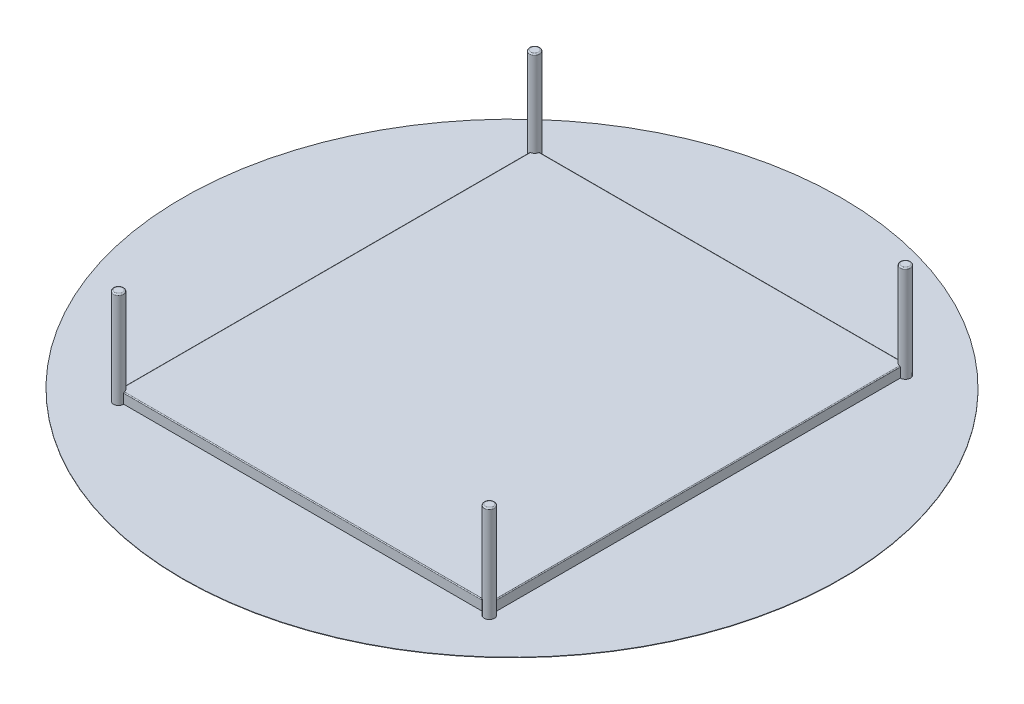
from build123d import *

# Parameters (mm, degrees)
SKETCH1_R           = 800
BOSS_EXTRUDE1_DEPTH = 1
SKETCH2_W           = 900
SKETCH2_H           = 1010
BOSS_EXTRUDE2_DEPTH = 25
SKETCH3_R           = 12.5
BOSS_EXTRUDE3_DEPTH = 234
FILLET2_R           = 2
FILLET3_R           = 3


with BuildPart() as part:
    # Sketch1 → Boss-Extrude1 (new body)
    with BuildSketch(Plane(origin=(0, 0, 0), x_dir=(1, 0, 0), z_dir=(0, 1, 0))):
        with Locations(Location((0, 0, 0), (0, 0, 270))):
            Circle(SKETCH1_R)
    extrude(amount=BOSS_EXTRUDE1_DEPTH)

    # Sketch3 → Boss-Extrude3 (add)
    with BuildSketch(Plane(origin=(0, 1, 0), x_dir=(1, 0, 0), z_dir=(0, 1, 0))):
        with Locations(Location((-450, -505, 0), (0, 0, 270))):
            Circle(SKETCH3_R)
        with Locations(Location((450, -505, 0), (0, 0, 270))):
            Circle(SKETCH3_R)
        with Locations(Location((450, 505, 0), (0, 0, 270))):
            Circle(SKETCH3_R)
        with Locations(Location((-450, 505, 0), (0, 0, 270))):
            Circle(SKETCH3_R)
    extrude(amount=BOSS_EXTRUDE3_DEPTH)

    # Fillet3
    fillet3_edges = [part.edges().sort_by_distance(p)[0] for p in [
        (450, 235, -517.5),
        (-450, 235, -517.5),
        (-450, 235, 492.5),
        (450, 235, 492.5),
    ]]
    fillet(fillet3_edges, radius=FILLET3_R)


with BuildPart() as body_2:
    # Sketch2 → Boss-Extrude2 (new body)
    with BuildSketch(Plane(origin=(0, 1, 0), x_dir=(1, 0, 0), z_dir=(0, 1, 0))):
        Rectangle(SKETCH2_W, SKETCH2_H)
    extrude(amount=BOSS_EXTRUDE2_DEPTH)

    # Fillet2
    fillet2_edges = [body_2.edges().sort_by_distance(p)[0] for p in [
        (-450, 26, 0),
        (0, 26, 505),
        (450, 26, 0),
        (0, 26, -505),
    ]]
    fillet(fillet2_edges, radius=FILLET2_R)


solid = Compound([part.part, body_2.part])
